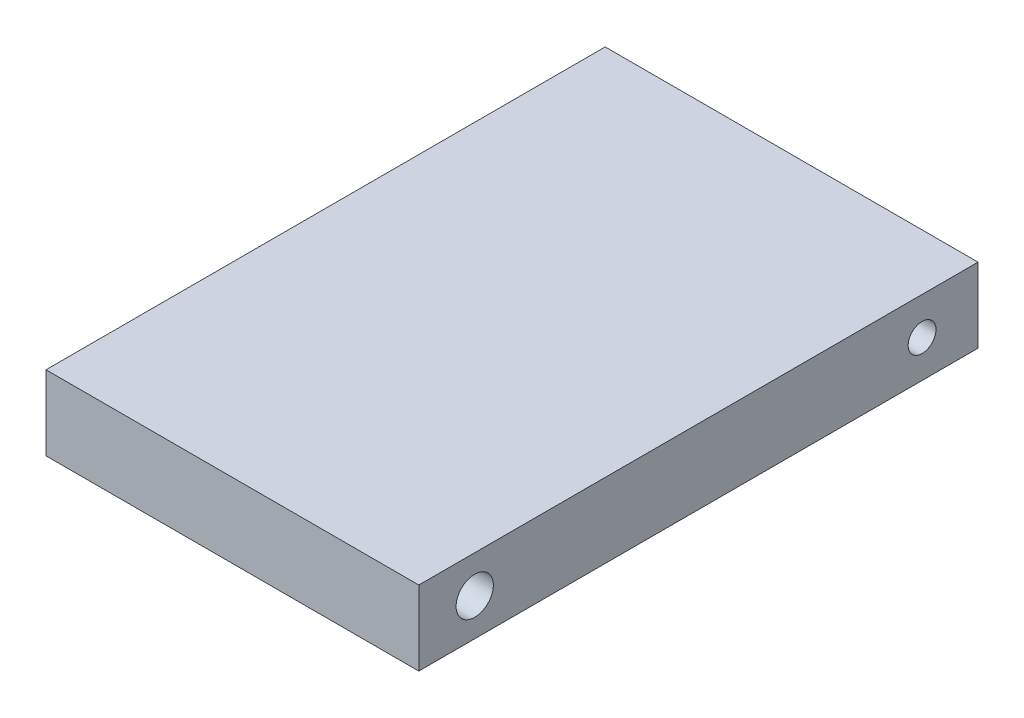
from build123d import *

# Parameters (mm, degrees)
SKETCH1_W           = 127
SKETCH1_H           = 190.5
BOSS_EXTRUDE1_DEPTH = 25.4
SKETCH2_R           = 6.35
CUT_EXTRUDE1_DEPTH  = 19.05
SKETCH3_R           = 4.741125957
CUT_EXTRUDE2_DEPTH  = 19.05
CUT_EXTRUDE3_START  = -19.05
SKETCH8_R           = 6.35
CUT_EXTRUDE3_DEPTH  = 19.05


with BuildPart() as part:
    # Sketch1 → Boss-Extrude1 (new body)
    with BuildSketch(Plane(origin=(0, 0, 0), x_dir=(1, 0, 0), z_dir=(0, 1, 0))):
        with Locations((63.5, 95.25)):
            Rectangle(SKETCH1_W, SKETCH1_H)
    extrude(amount=BOSS_EXTRUDE1_DEPTH)

    # Sketch2 → Cut-Extrude1 (cut)
    with BuildSketch(Plane(origin=(127, 0, 0), x_dir=(0, 0, -1), z_dir=(1, 0, 0))):
        with Locations((19.05, 12.7)):
            Circle(SKETCH2_R)
    extrude(amount=-CUT_EXTRUDE1_DEPTH, mode=Mode.SUBTRACT)

    # Sketch3 → Cut-Extrude2 (cut)
    with BuildSketch(Plane(origin=(127, 0, 0), x_dir=(0, 0, -1), z_dir=(1, 0, 0))):
        with Locations((171.45, 12.7)):
            Circle(SKETCH3_R)
    extrude(amount=-CUT_EXTRUDE2_DEPTH, mode=Mode.SUBTRACT)

    # Sketch8 → Cut-Extrude3 (cut)
    with BuildSketch(Plane.ZY.offset(CUT_EXTRUDE3_START)):
        with Locations((-171.45, 12.7)):
            Circle(SKETCH8_R)
        with Locations(Location((-19.05, 12.7, 0), (0, 0, 180))):
            Circle(SKETCH8_R)
    extrude(amount=CUT_EXTRUDE3_DEPTH, mode=Mode.SUBTRACT)


solid = part.part
